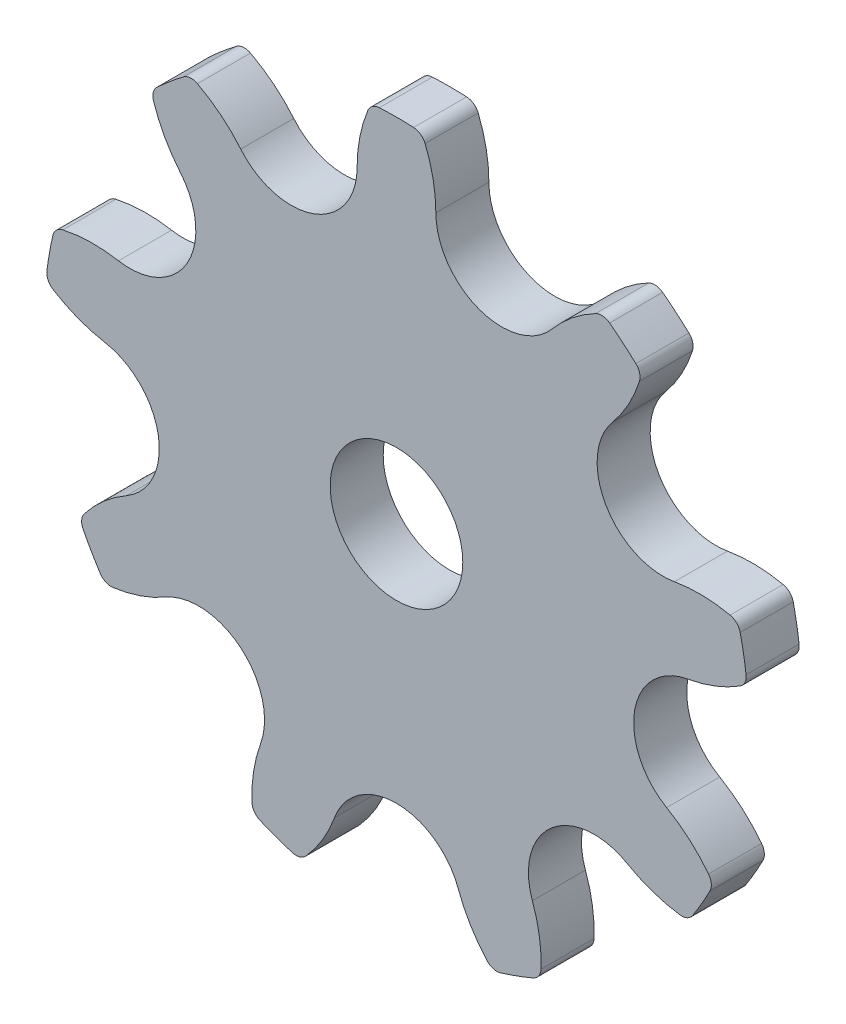
from build123d import *

# Parameters (mm, degrees)
BOSS_EXTRUDE1_DEPTH = 3.2
SKETCH2_R           = 4
CUT_EXTRUDE1_DEPTH  = 10


with BuildPart() as part:
    # Sketch1 → Boss-Extrude1 (new body)
    with BuildSketch(Plane.XY):
        with BuildLine():
            ThreePointArc((2.3749, 17.446481614), (2.211827147, 19.125468185), (1.72870442, 20.741692518))
            ThreePointArc((1.72870442, 20.741692518), (1.452377955, 21.089746522), (1.03228327, 21.234723622))
            ThreePointArc((1.03228327, 21.234723622), (0, 21.2598), (-1.03228327, 21.234723622))
            ThreePointArc((-1.03228327, 21.234723622), (-1.452377955, 21.089746522), (-1.72870442, 20.741692518))
            ThreePointArc((-1.72870442, 20.741692518), (-2.211827147, 19.125468185), (-2.3749, 17.446481614))
            ThreePointArc((-2.3749, 17.446481614), (-4.990435728, 13.711109477), (-9.395103266, 14.891336586))
            ThreePointArc((-9.395103266, 14.891336586), (-10.599256083, 16.07269371), (-12.00823854, 17.000248076))
            ThreePointArc((-12.00823854, 17.000248076), (-12.443641694, 17.089253684), (-12.858642377, 16.930280927))
            ThreePointArc((-12.858642377, 16.930280927), (-13.665536024, 16.285951652), (-14.440192102, 15.603203136))
            ThreePointArc((-14.440192102, 15.603203136), (-14.668813817, 15.222112575), (-14.656767369, 14.777868512))
            ThreePointArc((-14.656767369, 14.777868512), (-13.987971874, 13.22922354), (-13.033661162, 11.838223998))
            ThreePointArc((-13.033661162, 11.838223998), (-12.636226845, 7.295528971), (-16.769033299, 5.368369672))
            ThreePointArc((-16.769033299, 5.368369672), (-18.450829595, 5.49932722), (-20.12639323, 5.304198623))
            ThreePointArc((-20.12639323, 5.304198623), (-20.517143098, 5.092509122), (-20.732866347, 4.703971627))
            ThreePointArc((-20.732866347, 4.703971627), (-20.936815867, 3.691725528), (-21.091374564, 2.670770493))
            ThreePointArc((-21.091374564, 2.670770493), (-21.021548669, 2.23188298), (-20.726765974, 1.899315592))
            ThreePointArc((-20.726765974, 1.899315592), (-19.218989102, 1.142878174), (-17.593827413, 0.690729806))
            ThreePointArc((-17.593827413, 0.690729806), (-14.369386985, -2.533710622), (-16.296546284, -6.666517075))
            ThreePointArc((-16.296546284, -6.666517075), (-17.669054881, -7.647235594), (-18.827184848, -8.873744316))
            ThreePointArc((-18.827184848, -8.873744316), (-18.990445225, -9.287077056), (-18.905951734, -9.723378276))
            ThreePointArc((-18.905951734, -9.723378276), (-18.411526879, -10.6299), (-17.873668464, -11.511345346))
            ThreePointArc((-17.873668464, -11.511345346), (-17.538067269, -11.802669466), (-17.098480428, -11.867948202))
            ThreePointArc((-17.098480428, -11.867948202), (-15.457227734, -11.478232591), (-13.921646284, -10.779964538))
            ThreePointArc((-13.921646284, -10.779964538), (-9.378951257, -11.177398855), (-8.198724147, -15.582066393))
            ThreePointArc((-8.198724147, -15.582066393), (-8.619733019, -17.215571885), (-8.718527435, -18.899563668))
            ThreePointArc((-8.718527435, -18.899563668), (-8.577906975, -19.321136664), (-8.232732188, -19.60105142))
            ThreePointArc((-8.232732188, -19.60105142), (-7.271279843, -19.977677179), (-6.292674246, -20.307174764))
            ThreePointArc((-6.292674246, -20.307174764), (-5.848329281, -20.314621697), (-5.469625861, -20.082067135))
            ThreePointArc((-5.469625861, -20.082067135), (-4.462857721, -18.728550761), (-3.735372137, -17.206593669))
            ThreePointArc((-3.735372137, -17.206593669), (0, -14.591057941), (3.735372137, -17.206593669))
            ThreePointArc((3.735372137, -17.206593669), (4.462857721, -18.728550761), (5.469625861, -20.082067135))
            ThreePointArc((5.469625861, -20.082067135), (5.848329281, -20.314621697), (6.292674246, -20.307174764))
            ThreePointArc((6.292674246, -20.307174764), (7.271279843, -19.977677179), (8.232732188, -19.60105142))
            ThreePointArc((8.232732188, -19.60105142), (8.577906975, -19.321136664), (8.718527435, -18.899563668))
            ThreePointArc((8.718527435, -18.899563668), (8.619733019, -17.215571885), (8.198724147, -15.582066393))
            ThreePointArc((8.198724147, -15.582066393), (9.378951257, -11.177398855), (13.921646284, -10.779964538))
            ThreePointArc((13.921646284, -10.779964538), (15.457227734, -11.478232591), (17.098480428, -11.867948202))
            ThreePointArc((17.098480428, -11.867948202), (17.538067269, -11.802669466), (17.873668464, -11.511345346))
            ThreePointArc((17.873668464, -11.511345346), (18.411526879, -10.6299), (18.905951734, -9.723378276))
            ThreePointArc((18.905951734, -9.723378276), (18.990445225, -9.287077056), (18.827184848, -8.873744316))
            ThreePointArc((18.827184848, -8.873744316), (17.669054881, -7.647235594), (16.296546284, -6.666517075))
            ThreePointArc((16.296546284, -6.666517075), (14.369386985, -2.533710622), (17.593827413, 0.690729806))
            ThreePointArc((17.593827413, 0.690729806), (19.218989102, 1.142878174), (20.726765974, 1.899315592))
            ThreePointArc((20.726765974, 1.899315592), (21.021548669, 2.23188298), (21.091374564, 2.670770493))
            ThreePointArc((21.091374564, 2.670770493), (20.936815867, 3.691725528), (20.732866347, 4.703971627))
            ThreePointArc((20.732866347, 4.703971627), (20.517143098, 5.092509122), (20.12639323, 5.304198623))
            ThreePointArc((20.12639323, 5.304198623), (18.450829595, 5.49932722), (16.769033299, 5.368369672))
            ThreePointArc((16.769033299, 5.368369672), (12.636226845, 7.295528971), (13.033661162, 11.838223998))
            ThreePointArc((13.033661162, 11.838223998), (13.987971874, 13.22922354), (14.656767369, 14.777868512))
            ThreePointArc((14.656767369, 14.777868512), (14.668813817, 15.222112575), (14.440192102, 15.603203136))
            ThreePointArc((14.440192102, 15.603203136), (13.665536024, 16.285951652), (12.858642377, 16.930280927))
            ThreePointArc((12.858642377, 16.930280927), (12.443641694, 17.089253684), (12.00823854, 17.000248076))
            ThreePointArc((12.00823854, 17.000248076), (10.599256083, 16.07269371), (9.395103266, 14.891336586))
            ThreePointArc((9.395103266, 14.891336586), (4.990435728, 13.711109477), (2.3749, 17.446481614))
        make_face()
    extrude(amount=-BOSS_EXTRUDE1_DEPTH)

    # Sketch2 → Cut-Extrude1 (cut)
    with BuildSketch(Plane.XY):
        Circle(SKETCH2_R)
    extrude(amount=-CUT_EXTRUDE1_DEPTH, mode=Mode.SUBTRACT)


solid = part.part
